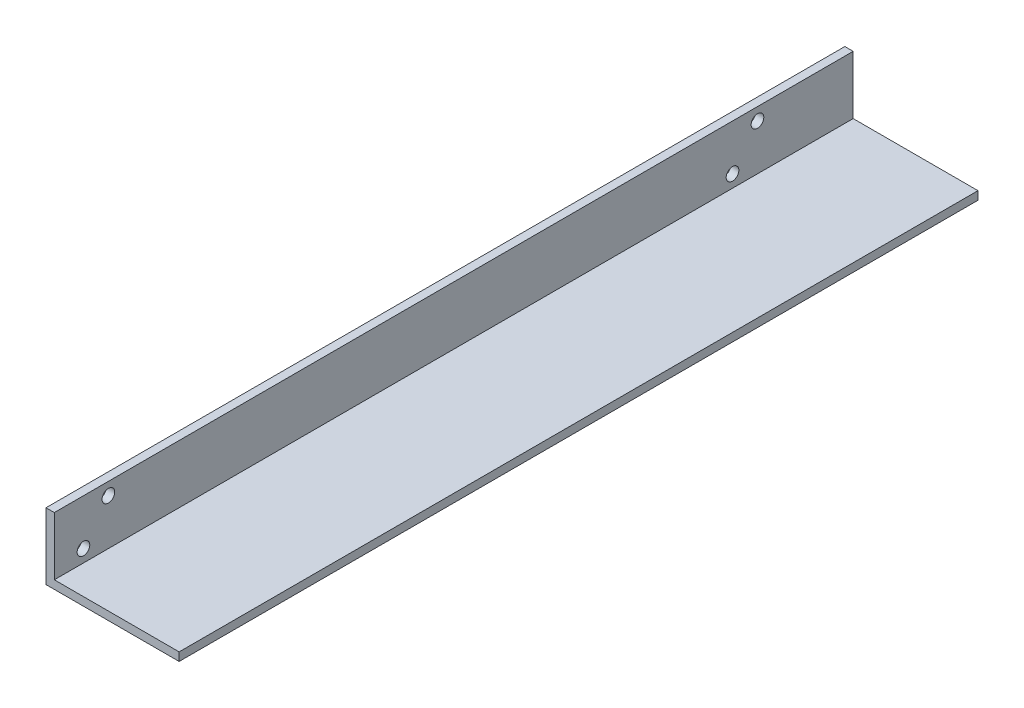
from build123d import *

# Parameters (mm, degrees)
BOSS_EXTRUDE1_DEPTH = 304.8
CUT_EXTRUDE1_REACH  = 312.047
SKETCH2_R           = 2.413


with BuildPart() as part:
    # Sketch1 → Boss-Extrude1 (new body)
    with BuildSketch(Plane.XY):
        Polygon((3.175, 3.175), (3.175, 25.4), (0, 25.4), (0, 0), (50.8, 0), (50.8, 3.175), align=None)
    extrude(amount=BOSS_EXTRUDE1_DEPTH)

    # Sketch2 → Cut-Extrude1 (cut, up to next)
    with BuildSketch(Plane.ZY, mode=Mode.PRIVATE) as cut_extrude1_sk1:
        with Locations((36.5125, 20.6375)):
            Circle(SKETCH2_R)
    cut_extrude1_tool1 = extrude(cut_extrude1_sk1.sketch, amount=-CUT_EXTRUDE1_REACH, mode=Mode.PRIVATE) & part.part
    # Sketch2 → Cut-Extrude1 (cut, up to next)
    with BuildSketch(Plane.ZY, mode=Mode.PRIVATE) as cut_extrude1_sk2:
        with Locations((46.0375, 7.9375)):
            Circle(SKETCH2_R)
    cut_extrude1_tool2 = extrude(cut_extrude1_sk2.sketch, amount=-CUT_EXTRUDE1_REACH, mode=Mode.PRIVATE) & part.part
    # Sketch2 → Cut-Extrude1 (cut, up to next)
    with BuildSketch(Plane.ZY, mode=Mode.PRIVATE) as cut_extrude1_sk3:
        with Locations((284.1625, 20.6375)):
            Circle(SKETCH2_R)
    cut_extrude1_tool3 = extrude(cut_extrude1_sk3.sketch, amount=-CUT_EXTRUDE1_REACH, mode=Mode.PRIVATE) & part.part
    # Sketch2 → Cut-Extrude1 (cut, up to next)
    with BuildSketch(Plane.ZY, mode=Mode.PRIVATE) as cut_extrude1_sk4:
        with Locations((293.6875, 7.9375)):
            Circle(SKETCH2_R)
    cut_extrude1_tool4 = extrude(cut_extrude1_sk4.sketch, amount=-CUT_EXTRUDE1_REACH, mode=Mode.PRIVATE) & part.part
    add(cut_extrude1_tool1.solids().sort_by_distance((0, 20.6375, 36.5125))[0], mode=Mode.SUBTRACT)
    add(cut_extrude1_tool2.solids().sort_by_distance((0, 7.9375, 46.0375))[0], mode=Mode.SUBTRACT)
    add(cut_extrude1_tool3.solids().sort_by_distance((0, 20.6375, 284.1625))[0], mode=Mode.SUBTRACT)
    add(cut_extrude1_tool4.solids().sort_by_distance((0, 7.9375, 293.6875))[0], mode=Mode.SUBTRACT)


solid = part.part
